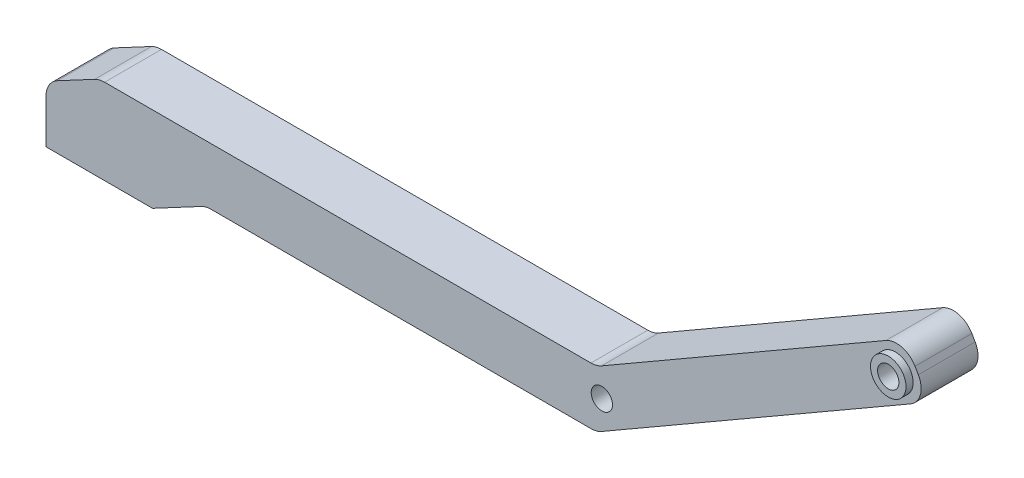
from build123d import *

# Parameters (mm, degrees)
SKETCH_1_R      = 1.5
EXTRUDE_1_DEPTH = 8
FILLET_1_R      = 3
SKETCH_2_R      = 2.5
SKETCH_2_R_2    = 1.5
EXTRUDE_2_DEPTH = 1


with BuildPart() as part:
    # 草图1 → 凸台-拉伸1 (new body)
    with BuildSketch(Plane.XY):
        Polygon((-7.5, 4), (-7.5, -4), (7.5, -4), (15, 0), (70, 0), (116.765371804, 27), (113.301270189, 33), (70, 8), (0, 8), align=None)
        with Locations((112.0368731, 28.27)):
            Circle(SKETCH_1_R, mode=Mode.SUBTRACT)
        with Locations((70.727461339, 4.42)):
            Circle(SKETCH_1_R, mode=Mode.SUBTRACT)
    extrude(amount=EXTRUDE_1_DEPTH)

    # 圆角1
    fillet_1_edges = [part.edges().sort_by_distance(p)[0] for p in [
        (-7.5, 4, 4),
        (0, 8, 4),
        (70, 8, 4),
        (113.301270189, 33, 4),
        (116.765371804, 27, 4),
        (70, 0, 4),
        (15, 0, 4),
    ]]
    fillet(fillet_1_edges, radius=FILLET_1_R)

    # 草图2 → 凸台-拉伸2 (add)
    with BuildSketch(Plane.XY.offset(8)):
        with Locations((112.0368731, 28.27)):
            Circle(SKETCH_2_R)
        with Locations((112.0368731, 28.27)):
            Circle(SKETCH_2_R_2, mode=Mode.SUBTRACT)
    extrude(amount=EXTRUDE_2_DEPTH)


solid = part.part
